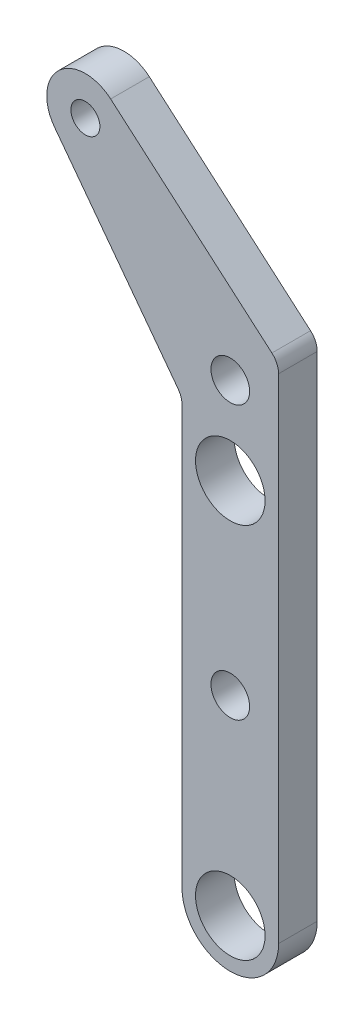
from build123d import *

# Parameters (mm, degrees)
SKETCH_2_R      = 3.6
SKETCH_2_R_2    = 1.5
SKETCH_2_R_3    = 2
EXTRUDE_1_DEPTH = 4
FILLET_1_R      = 2


with BuildPart() as part:
    # 草图2 → 凸台-拉伸1 (new body)
    with BuildSketch(Plane.XY):
        with BuildLine():
            Line((-65, 0), (-65, 44))
            Line((-65, 44), (-78.2, 61.6))
            ThreePointArc((-78.2, 61.6), (-77.728789328, 66.924672427), (-72.384272007, 67.026213321))
            Line((-72.384272007, 67.026213321), (-55, 52))
            Line((-55, 52), (-55, 0))
            ThreePointArc((-55, 0), (-60, -5), (-65, 0))
        make_face()
        with Locations((-60, 39)):
            Circle(SKETCH_2_R, mode=Mode.SUBTRACT)
        with Locations((-60, 0)):
            Circle(SKETCH_2_R, mode=Mode.SUBTRACT)
        with Locations((-75, 64)):
            Circle(SKETCH_2_R_2, mode=Mode.SUBTRACT)
        with Locations((-60, 19.75)):
            Circle(SKETCH_2_R_3, mode=Mode.SUBTRACT)
        with Locations((-60, 48)):
            Circle(SKETCH_2_R_3, mode=Mode.SUBTRACT)
    extrude(amount=EXTRUDE_1_DEPTH)

    # 圆角1
    fillet_1_edges = [part.edges().sort_by_distance(p)[0] for p in [
        (-55, 52, 2),
        (-65, 44, 2),
    ]]
    fillet(fillet_1_edges, radius=FILLET_1_R)


solid = part.part
